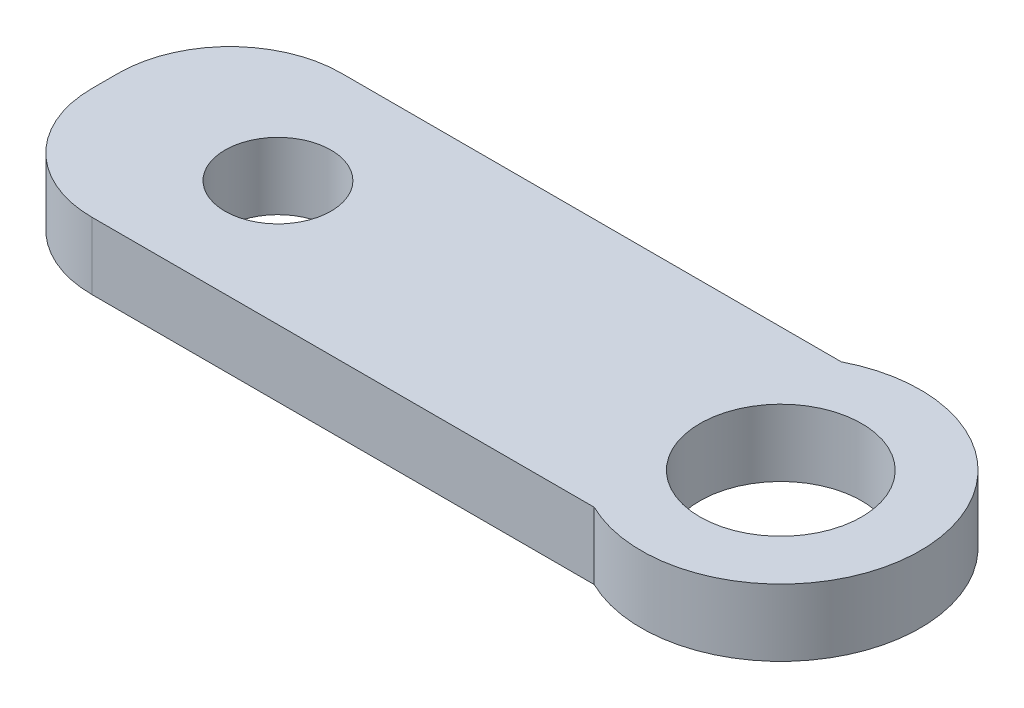
from build123d import *

# Parameters (mm, degrees)
EXTRUDE_1_DEPTH     = 1.2
SKETCH_2_R          = 1.45
CUT_EXTRUDE_1_DEPTH = 13.410758407
FILLET_1_R          = 2
SKETCH_3_R          = 0.95
CUT_EXTRUDE_2_DEPTH = 13.410758407


with BuildPart() as part:
    # 草图1 → 凸台-拉伸1 (new body)
    with BuildSketch(Plane(origin=(0, 0, 0), x_dir=(1, 0, 0), z_dir=(0, 1, 0))):
        with BuildLine():
            Line((-1.096979963, -2.246471669), (-12.096979963, -2.246471669))
            Line((-12.096979963, -2.246471669), (-12.096979963, 2.224581144))
            Line((-12.096979963, 2.224581144), (-1.140718517, 2.224581144))
            ThreePointArc((-1.140718517, 2.224581144), (2.499880384, 0.024455348), (-1.096979963, -2.246471669))
        make_face()
    extrude(amount=EXTRUDE_1_DEPTH)

    # 草图2 → 切除-拉伸1 (cut, through all)
    with BuildSketch(Plane(origin=(0, 1.2, 0), x_dir=(1, 0, 0), z_dir=(0, 1, 0))):
        with Locations(Location((0, 0, 0), (0, 0, 270))):
            Circle(SKETCH_2_R)
    extrude(amount=-CUT_EXTRUDE_1_DEPTH, mode=Mode.SUBTRACT)

    # 圆角1
    fillet_1_edges = [part.edges().sort_by_distance(p)[0] for p in [
        (-12.096979963, 0.6, 2.246471669),
        (-12.096979963, 0.6, -2.224581144),
    ]]
    fillet(fillet_1_edges, radius=FILLET_1_R)

    # 草图3 → 切除-拉伸2 (cut, through all)
    with BuildSketch(Plane(origin=(0, 1.2, 0), x_dir=(1, 0, 0), z_dir=(0, 1, 0))):
        with Locations(Location((-9, -0.010945263, 0), (0, 0, 270))):
            Circle(SKETCH_3_R)
    extrude(amount=-CUT_EXTRUDE_2_DEPTH, mode=Mode.SUBTRACT)


solid = part.part
